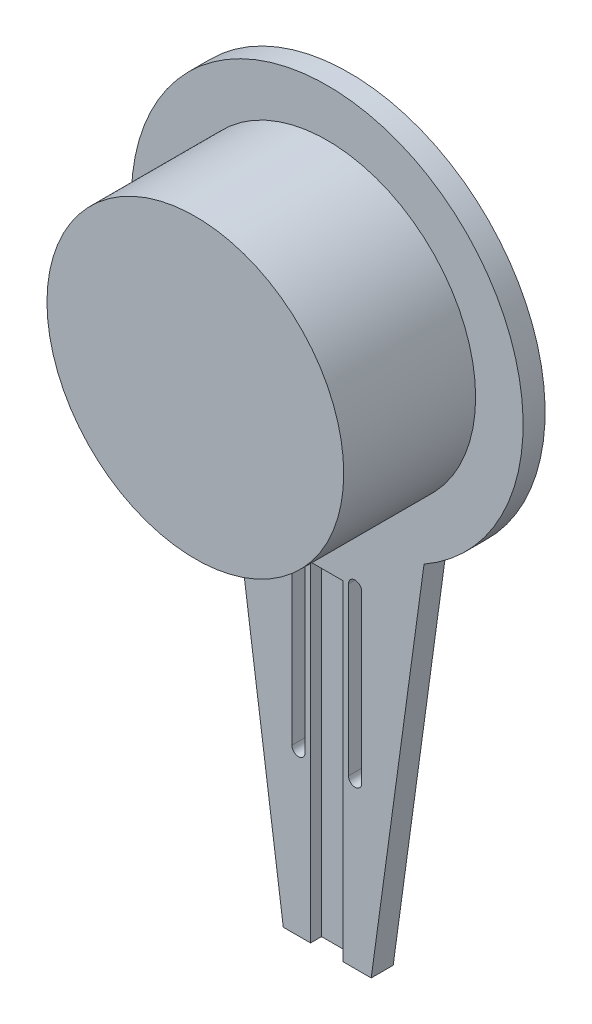
from build123d import *

# Parameters (mm, degrees)
BOSS_EXTRUDE1_DEPTH = 5.08
SKETCH4_W           = 7.497155508
SKETCH4_H           = 76.250815091
CUT_EXTRUDE3_DEPTH  = 2.54
CUT_EXTRUDE4_DEPTH  = 5.08
SKETCH11_R          = 34.29
BOSS_EXTRUDE3_DEPTH = 30.48


with BuildPart() as part:
    # Sketch1 → Boss-Extrude1 (new body)
    with BuildSketch(Plane.XY):
        with BuildLine():
            Line((-26.055152411, -104.455615698), (-36.215152411, -104.455615698))
            Line((-36.215152411, -104.455615698), (-41.295152411, -104.455615698))
            Line((-41.295152411, -104.455615698), (-53.504081842, -15.511778924))
            ThreePointArc((-53.504081842, -15.511778924), (-31.135152411, 69.114610814), (-8.76622298, -15.511778924))
            Line((-8.76622298, -15.511778924), (-20.975152411, -104.455615698))
            Line((-20.975152411, -104.455615698), (-26.055152411, -104.455615698))
        make_face()
    extrude(amount=BOSS_EXTRUDE1_DEPTH)

    # Sketch4 → Cut-Extrude3 (cut)
    with BuildSketch(Plane.XY.offset(5.08)):
        with Locations((-31.244121472, -66.330208153)):
            Rectangle(SKETCH4_W, SKETCH4_H)
    extrude(amount=-CUT_EXTRUDE3_DEPTH, mode=Mode.SUBTRACT)

    # Sketch5 → Cut-Extrude4 (cut)
    with BuildSketch(Plane.XY.offset(5.08)):
        with BuildLine():
            Line((-36.262699226, -28.204800607), (-36.262699226, -67.040609222))
            ThreePointArc((-36.262699226, -67.040609222), (-37.786699226, -68.564609222), (-39.310699226, -67.040609222))
            Line((-39.310699226, -67.040609222), (-39.310699226, -28.204800607))
            ThreePointArc((-39.310699226, -28.204800607), (-37.786699226, -26.680800607), (-36.262699226, -28.204800607))
        make_face()
        with BuildLine():
            Line((-23.177543718, -28.204800607), (-23.177543718, -66.616952793))
            ThreePointArc((-23.177543718, -66.616952793), (-24.701543718, -68.140952793), (-26.225543718, -66.616952793))
            Line((-26.225543718, -66.616952793), (-26.225543718, -28.204800607))
            ThreePointArc((-26.225543718, -28.204800607), (-24.701543718, -26.680800607), (-23.177543718, -28.204800607))
        make_face()
    extrude(amount=-CUT_EXTRUDE4_DEPTH, mode=Mode.SUBTRACT)

    # Sketch11 → Boss-Extrude3 (add)
    with BuildSketch(Plane.XY.offset(5.08)):
        with Locations(Location((-31.135152411, 23.845074516, 0), (0, 0, 180))):
            Circle(SKETCH11_R)
    extrude(amount=BOSS_EXTRUDE3_DEPTH)


solid = part.part
